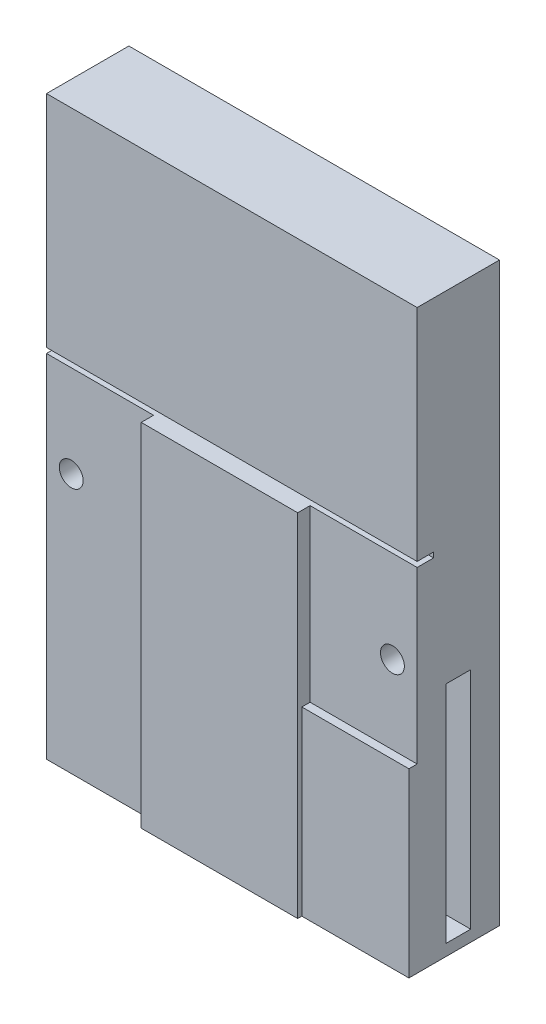
from build123d import *

# Parameters (mm, degrees)
SKETCH2_W           = 45
SKETCH2_H           = 10
BOSS_EXTRUDE1_DEPTH = 40
SKETCH4_W           = 45
SKETCH4_H           = 10
BOSS_EXTRUDE2_DEPTH = 10
SKETCH8_W           = 45
SKETCH8_H           = 10
BOSS_EXTRUDE3_DEPTH = 20
SKETCH9_R           = 1.45
CUT_EXTRUDE2_DEPTH  = 20
SKETCH10_W          = 45
SKETCH10_H          = 0.626165357
CUT_EXTRUDE3_DEPTH  = 2
SKETCH11_W          = 19
SKETCH11_H          = 42.671327575
BOSS_EXTRUDE4_DEPTH = 1.5
SKETCH12_W          = 3
SKETCH12_H          = 27.286335608
CUT_EXTRUDE6_DEPTH  = 10
SKETCH13_W          = 13
SKETCH13_H          = 22
BOSS_EXTRUDE5_DEPTH = 1


with BuildPart() as part:
    # Sketch2 → Boss-Extrude1 (new body)
    with BuildSketch(Plane(origin=(0, 0, 0), x_dir=(1, 0, 0), z_dir=(0, 1, 0))):
        Rectangle(SKETCH2_W, SKETCH2_H)
    extrude(amount=BOSS_EXTRUDE1_DEPTH)

    # Sketch4 → Boss-Extrude2 (add)
    with BuildSketch(Plane(origin=(0, 40, 0), x_dir=(1, 0, 0), z_dir=(0, 1, 0))):
        Rectangle(SKETCH4_W, SKETCH4_H)
    extrude(amount=BOSS_EXTRUDE2_DEPTH)

    # Sketch8 → Boss-Extrude3 (add)
    with BuildSketch(Plane.XZ):
        Rectangle(SKETCH8_W, SKETCH8_H)
    extrude(amount=BOSS_EXTRUDE3_DEPTH)

    # Sketch9 → Cut-Extrude2 (cut)
    with BuildSketch(Plane.XY.offset(5)):
        with Locations((19.5, 11.5)):
            Circle(SKETCH9_R)
        with Locations((-19.5, 11.5)):
            Circle(SKETCH9_R)
    extrude(amount=-CUT_EXTRUDE2_DEPTH, mode=Mode.SUBTRACT)

    # Sketch10 → Cut-Extrude3 (cut)
    with BuildSketch(Plane.XY.offset(5)):
        with Locations((0, 22.984410254)):
            Rectangle(SKETCH10_W, SKETCH10_H)
    extrude(amount=-CUT_EXTRUDE3_DEPTH, mode=Mode.SUBTRACT)

    # Sketch11 → Boss-Extrude4 (add)
    with BuildSketch(Plane.XY.offset(5)):
        with Locations((0, 1.335663788)):
            Rectangle(SKETCH11_W, SKETCH11_H)
    extrude(amount=BOSS_EXTRUDE4_DEPTH)

    # Sketch12 → Cut-Extrude6 (cut)
    with BuildSketch(Plane(origin=(22.5, 0, 0), x_dir=(0, 0, -1), z_dir=(1, 0, 0))):
        with Locations((0, -4.971840229)):
            Rectangle(SKETCH12_W, SKETCH12_H)
    extrude(amount=-CUT_EXTRUDE6_DEPTH, mode=Mode.SUBTRACT)

    # Sketch13 → Boss-Extrude5 (add)
    with BuildSketch(Plane.XY.offset(5)):
        with Locations((16, -9)):
            Rectangle(SKETCH13_W, SKETCH13_H)
    extrude(amount=BOSS_EXTRUDE5_DEPTH)


solid = part.part
